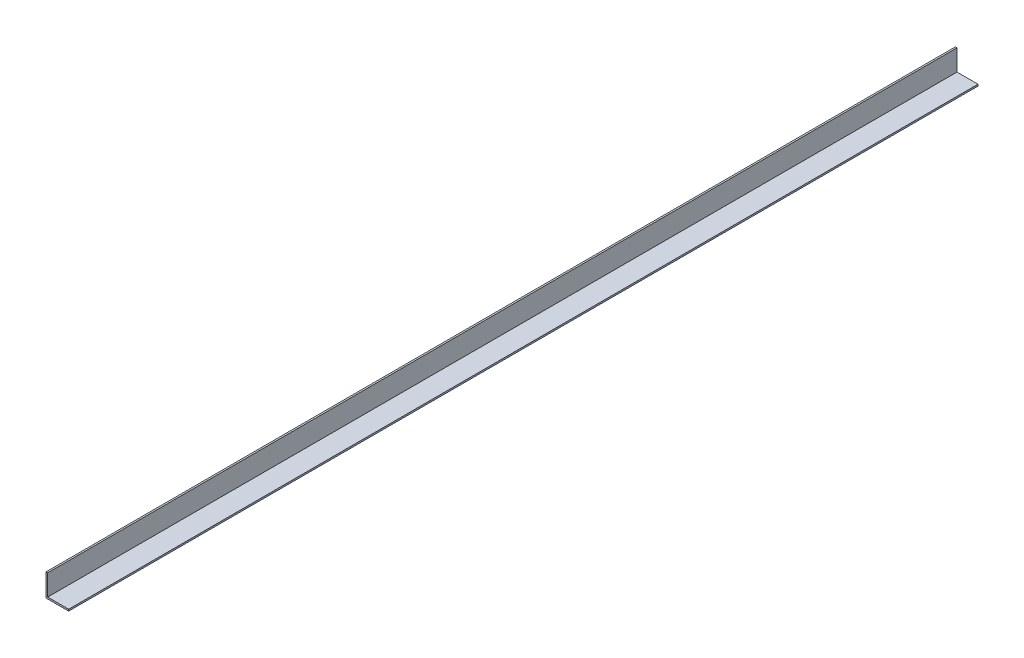
from build123d import *

# Parameters (mm, degrees)
SALIENTE_EXTRUIR1_DEPTH = 6100


with BuildPart() as part:
    # Croquis1 → Saliente-Extruir1 (new body)
    with BuildSketch(Plane.XY):
        Polygon((0, 152), (0, 0), (152, 0), (152, 11.1), (11.1, 11.1), (11.1, 152), align=None)
    extrude(amount=-SALIENTE_EXTRUIR1_DEPTH)


solid = part.part
